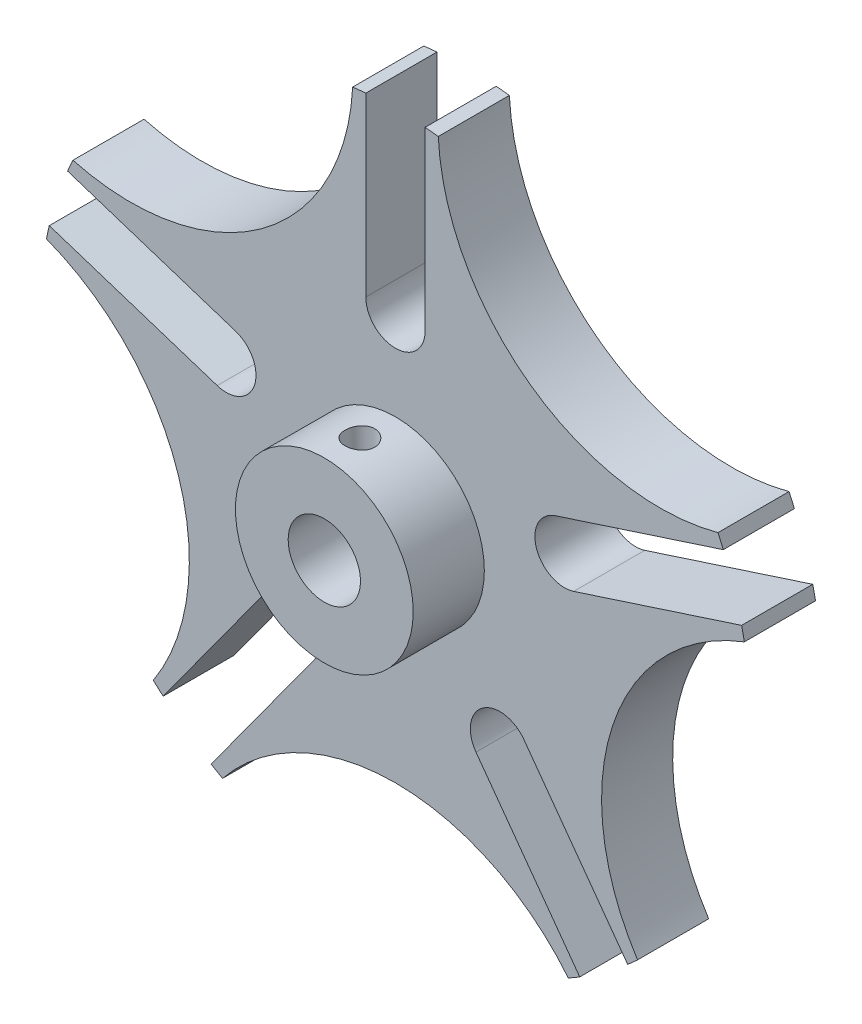
from build123d import *

# Parameters (mm, degrees)
SKETCH1_R                 = 7.5
EXTRUDE1_DEPTH            = 3
SKETCH2_R                 = 30
EXTRUDE2_DEPTH            = 6
SKETCH3_R                 = 18.5
CUT_EXTRUDE1_DEPTH        = 45.09081537
CUT_EXTRUDE2_DEPTH        = 45.09081537
SKETCH8_R                 = 18.75
EXTRUDE3_DEPTH            = 45.09081537
CIRPATTERN1_COUNT         = 5
SKETCH5_R                 = 3.05
CUT_EXTRUDE3_DEPTH        = 44.640169222
M3X0_5_TAPPED_HOLE1_D     = 2.5
M3X0_5_TAPPED_HOLE1_DEPTH = 7.5
M3X0_5_TAPPED_HOLE1_TIP   = 0.751075774


with BuildPart() as part:
    # Sketch1 → Extrude1 (new, symmetric)
    with BuildSketch(Plane.XY):
        Circle(SKETCH1_R)
    extrude(amount=EXTRUDE1_DEPTH, both=True)

    # Sketch2 → Extrude2 (add)
    with BuildSketch(Plane(origin=(0, 0, -3), x_dir=(-1, 0, 0), z_dir=(0, 0, -1))):
        Circle(SKETCH2_R)
    extrude(amount=EXTRUDE2_DEPTH)

    # Sketch3 → Cut-Extrude1 (cut, through all)
    with BuildSketch(Plane(origin=(0, 0, -9), x_dir=(-1, 0, 0), z_dir=(0, 0, -1))):
        with Locations((0, -38)):
            Circle(SKETCH3_R)
    cut_extrude1 = extrude(amount=-CUT_EXTRUDE1_DEPTH, mode=Mode.SUBTRACT)

    # Sketch4 → Cut-Extrude2 (cut, through all)
    with BuildSketch(Plane(origin=(0, 0, -9), x_dir=(-1, 0, 0), z_dir=(0, 0, -1))):
        with BuildLine():
            Line((6.794236298, -13.604718046), (15.549680784, -25.655553542))
            ThreePointArc((15.549680784, -25.655553542), (17.633557569, -24.270509831), (19.594765756, -22.71662728))
            Line((19.594765756, -22.71662728), (10.83932127, -10.665791785))
            ThreePointArc((10.83932127, -10.665791785), (7.347315654, -10.11271243), (6.794236298, -13.604718046))
        make_face()
    cut_extrude2 = extrude(amount=-CUT_EXTRUDE2_DEPTH, mode=Mode.SUBTRACT)

    # Sketch8 → Extrude3 (cut, through all)
    with BuildSketch(Plane(origin=(0, 0, -9), x_dir=(-1, 0, 0), z_dir=(0, 0, -1))):
        with Locations((0, -38)):
            Circle(SKETCH8_R)
    extrude3 = extrude(amount=-EXTRUDE3_DEPTH, mode=Mode.SUBTRACT)

    # CirPattern1: Cut-Extrude1, Cut-Extrude2, Extrude3 ×5 about axis
    cirpattern1_axis = Axis((0, 0, -9.6), (0, 0, 1))
    add([cut_extrude1.rotate(cirpattern1_axis, i * 360 / CIRPATTERN1_COUNT) for i in range(1, CIRPATTERN1_COUNT)], mode=Mode.SUBTRACT)
    add([cut_extrude2.rotate(cirpattern1_axis, i * 360 / CIRPATTERN1_COUNT) for i in range(1, CIRPATTERN1_COUNT)], mode=Mode.SUBTRACT)
    add([extrude3.rotate(cirpattern1_axis, i * 360 / CIRPATTERN1_COUNT) for i in range(1, CIRPATTERN1_COUNT)], mode=Mode.SUBTRACT)

    # Sketch5 → Cut-Extrude3 (cut, through all)
    with BuildSketch(Plane(origin=(0, 0, -9), x_dir=(-1, 0, 0), z_dir=(0, 0, -1))):
        Circle(SKETCH5_R)
    extrude(amount=-CUT_EXTRUDE3_DEPTH, mode=Mode.SUBTRACT)

    # M3x0.5 Tapped Hole1
    with Locations(Plane(origin=(0, 7.5, 0), x_dir=(-1, 0, 0), z_dir=(0, 1, 0))):
        with Locations((0, 0)):
            Hole(M3X0_5_TAPPED_HOLE1_D / 2, depth=M3X0_5_TAPPED_HOLE1_DEPTH)
            with Locations((0, 0, -(M3X0_5_TAPPED_HOLE1_DEPTH + M3X0_5_TAPPED_HOLE1_TIP / 2))):  # 118° drill point
                Cone(0, M3X0_5_TAPPED_HOLE1_D / 2, M3X0_5_TAPPED_HOLE1_TIP, mode=Mode.SUBTRACT)


solid = part.part
